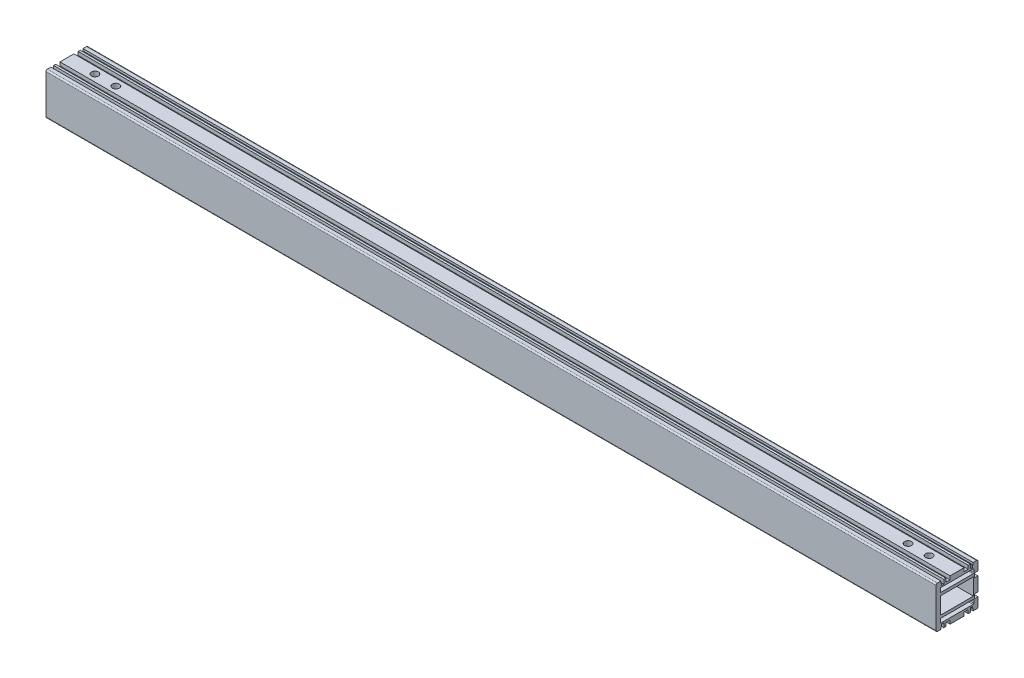
from build123d import *

# Parameters (mm, degrees)
SKETCH_1_W             = 23.5
SKETCH_1_H             = 12
EXTRUDE_1_DEPTH        = 318.5
HOLE_WIZARD_M6_1_D     = 5
HOLE_WIZARD_M6_1_DEPTH = 15
HOLE_WIZARD_M6_1_TIP   = 1.502151548
HOLE_WIZARD_M6_2_D     = 5
HOLE_WIZARD_M6_2_DEPTH = 15
HOLE_WIZARD_M6_2_TIP   = 1.502151548
HOLE_WIZARD_M4_1_D     = 3.3
HOLE_WIZARD_M4_1_DEPTH = 10.1
HOLE_WIZARD_M4_1_TIP   = 0.991420021


with BuildPart() as part:
    # 草图1 → 凸台-拉伸1 (new, symmetric)
    with BuildSketch(Plane(origin=(0, 0, 0), x_dir=(0, 0, -1), z_dir=(1, 0, 0))):
        with BuildLine():
            Line((-14, 15), (-11.5, 15))
            Line((-11.5, 15), (-11.5, 13.5))
            Line((-11.5, 13.5), (-11.4, 13.5))
            ThreePointArc((-11.4, 13.5), (-11.117157288, 13.382842712), (-11, 13.1))
            Line((-11, 13.1), (-11, 12))
            Line((-11, 12), (-9.5, 12))
            Line((-9.5, 12), (-9.5, 15))
            Line((-9.5, 15), (-8, 15))
            Line((-8, 15), (-8, 12.5))
            Line((-8, 12.5), (-5, 12.5))
            Line((-5, 12.5), (-5, 15))
            Line((-5, 15), (5, 15))
            Line((5, 15), (5, 12.5))
            Line((5, 12.5), (8, 12.5))
            Line((8, 12.5), (8, 15))
            Line((8, 15), (9.5, 15))
            Line((9.5, 15), (9.5, 12))
            Line((9.5, 12), (11, 12))
            Line((11, 12), (11, 13.1))
            ThreePointArc((11, 13.1), (11.117157288, 13.382842712), (11.4, 13.5))
            Line((11.4, 13.5), (11.5, 13.5))
            Line((11.5, 13.5), (11.5, 15))
            Line((11.5, 15), (14, 15))
            ThreePointArc((14, 15), (14.707106781, 14.707106781), (15, 14))
            Line((15, 14), (15, 8))
            Line((15, 8), (12.5, 8))
            Line((12.5, 8), (12.5, 5))
            Line((12.5, 5), (15, 5))
            Line((15, 5), (15, -5))
            Line((15, -5), (12.5, -5))
            Line((12.5, -5), (12.5, -8))
            Line((12.5, -8), (15, -8))
            Line((15, -8), (15, -14))
            ThreePointArc((15, -14), (14.707106781, -14.707106781), (14, -15))
            Line((14, -15), (11.5, -15))
            Line((11.5, -15), (11.5, -13.5))
            Line((11.5, -13.5), (11.4, -13.5))
            ThreePointArc((11.4, -13.5), (11.117157288, -13.382842712), (11, -13.1))
            Line((11, -13.1), (11, -12))
            Line((11, -12), (9.5, -12))
            Line((9.5, -12), (9.5, -15))
            Line((9.5, -15), (8, -15))
            Line((8, -15), (8, -12.5))
            Line((8, -12.5), (5, -12.5))
            Line((5, -12.5), (5, -15))
            Line((5, -15), (-5, -15))
            Line((-5, -15), (-5, -12.5))
            Line((-5, -12.5), (-8, -12.5))
            Line((-8, -12.5), (-8, -15))
            Line((-8, -15), (-9.5, -15))
            Line((-9.5, -15), (-9.5, -12))
            Line((-9.5, -12), (-11, -12))
            Line((-11, -12), (-11, -13.1))
            ThreePointArc((-11, -13.1), (-11.117157288, -13.382842712), (-11.4, -13.5))
            Line((-11.4, -13.5), (-11.5, -13.5))
            Line((-11.5, -13.5), (-11.5, -15))
            Line((-11.5, -15), (-14, -15))
            ThreePointArc((-14, -15), (-14.707106781, -14.707106781), (-15, -14))
            Line((-15, -14), (-15, 14))
            ThreePointArc((-15, 14), (-14.707106781, 14.707106781), (-14, 15))
        make_face()
        with BuildLine():
            Line((12, -10.5), (12, -8.5))
            ThreePointArc((12, -8.5), (11.853553391, -8.146446609), (11.5, -8))
            Line((11.5, -8), (-11.5, -8))
            ThreePointArc((-11.5, -8), (-11.853553391, -8.146446609), (-12, -8.5))
            Line((-12, -8.5), (-12, -10.5))
            ThreePointArc((-12, -10.5), (-11.853553391, -10.853553391), (-11.5, -11))
            Line((-11.5, -11), (11.5, -11))
            ThreePointArc((11.5, -11), (11.853553391, -10.853553391), (12, -10.5))
        make_face(mode=Mode.SUBTRACT)
        with BuildLine():
            Line((-11.5, 11), (11.5, 11))
            ThreePointArc((11.5, 11), (11.853553391, 10.853553391), (12, 10.5))
            Line((12, 10.5), (12, 8.5))
            ThreePointArc((12, 8.5), (11.853553391, 8.146446609), (11.5, 8))
            Line((11.5, 8), (-11.5, 8))
            ThreePointArc((-11.5, 8), (-11.853553391, 8.146446609), (-12, 8.5))
            Line((-12, 8.5), (-12, 10.5))
            ThreePointArc((-12, 10.5), (-11.853553391, 10.853553391), (-11.5, 11))
        make_face(mode=Mode.SUBTRACT)
        Rectangle(SKETCH_1_W, SKETCH_1_H, mode=Mode.SUBTRACT)
    extrude(amount=EXTRUDE_1_DEPTH, both=True)

    # M6 螺纹孔1
    with Locations(Plane(origin=(0, 15, 0), x_dir=(-1, 0, 0), z_dir=(0, 1, 0))):
        with Locations((298.5, 0), (283.5, 0), (-283.5, 0), (-298.5, 0)):
            Hole(HOLE_WIZARD_M6_1_D / 2, depth=HOLE_WIZARD_M6_1_DEPTH)
            with Locations((0, 0, -(HOLE_WIZARD_M6_1_DEPTH + HOLE_WIZARD_M6_1_TIP / 2))):  # 118° drill point
                Cone(0, HOLE_WIZARD_M6_1_D / 2, HOLE_WIZARD_M6_1_TIP, mode=Mode.SUBTRACT)

    # M6 螺纹孔2
    with Locations(Plane(origin=(0, 0, -15), x_dir=(-1, 0, 0), z_dir=(0, 0, -1))):
        with Locations((298.5, 0), (283.5, 0)):
            Hole(HOLE_WIZARD_M6_2_D / 2, depth=HOLE_WIZARD_M6_2_DEPTH)
            with Locations((0, 0, -(HOLE_WIZARD_M6_2_DEPTH + HOLE_WIZARD_M6_2_TIP / 2))):  # 118° drill point
                Cone(0, HOLE_WIZARD_M6_2_D / 2, HOLE_WIZARD_M6_2_TIP, mode=Mode.SUBTRACT)

    # M4 螺纹孔1
    with Locations(Plane(origin=(0, 0, -15), x_dir=(-1, 0, 0), z_dir=(0, 0, -1))):
        with Locations((-303.5, 0), (-118.5, 0), (1.5, 0), (98.5, 0), (248.5, 0)):
            Hole(HOLE_WIZARD_M4_1_D / 2, depth=HOLE_WIZARD_M4_1_DEPTH)
            with Locations((0, 0, -(HOLE_WIZARD_M4_1_DEPTH + HOLE_WIZARD_M4_1_TIP / 2))):  # 118° drill point
                Cone(0, HOLE_WIZARD_M4_1_D / 2, HOLE_WIZARD_M4_1_TIP, mode=Mode.SUBTRACT)


solid = part.part
